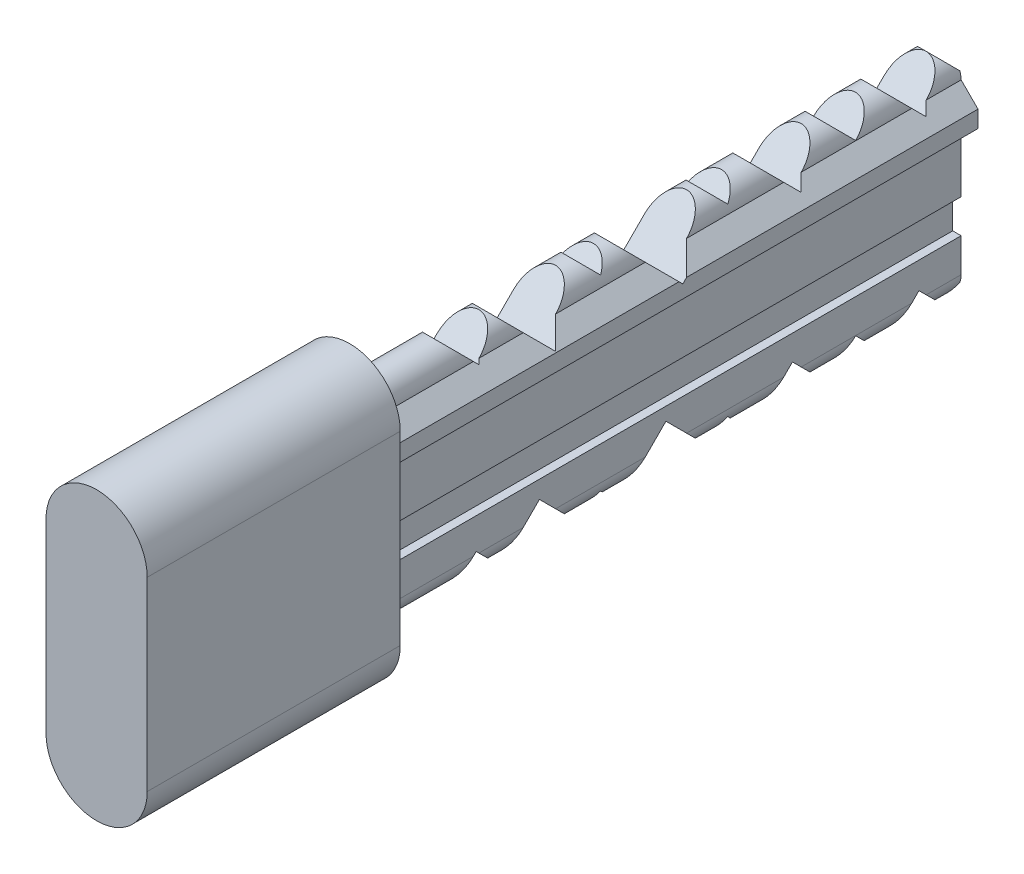
from build123d import *

# Parameters (mm, degrees)
KEY_MAIN_EXTURSION_DEPTH = 70
KEY_HANDLE_DEPTH         = 30
KEY_CUT_DEPTH            = 74.277343039


with BuildPart() as part:
    # Szkic1 → key-main-extursion (new body)
    with BuildSketch(Plane.XY):
        with BuildLine():
            Line((-1.381684649, -3.928424018), (-1.381684649, 4.071575982))
            Line((-1.381684649, 4.071575982), (-0.381684649, 4.071575982))
            Line((-0.381684649, 4.071575982), (-0.381684649, 8.071575982))
            Line((-0.381684649, 8.071575982), (-1.381684649, 8.071575982))
            Line((-1.381684649, 8.071575982), (-1.381684649, 12.071575982))
            ThreePointArc((-1.381684649, 12.071575982), (1.118315351, 14.571575982), (3.618315351, 12.071575982))
            Line((3.618315351, 12.071575982), (5.618315351, 10.071575982))
            Line((5.618315351, 10.071575982), (5.618315351, 8.071575982))
            Line((5.618315351, 8.071575982), (3.618315351, 8.071575982))
            Line((3.618315351, 8.071575982), (3.618315351, 0.071575982))
            Line((3.618315351, 0.071575982), (2.618315351, 0.071575982))
            Line((2.618315351, 0.071575982), (2.618315351, -3.928424018))
            Line((2.618315351, -3.928424018), (3.618315351, -3.928424018))
            Line((3.618315351, -3.928424018), (3.618315351, -7.928424018))
            ThreePointArc((3.618315351, -7.928424018), (1.118315351, -10.428424018), (-1.381684649, -7.928424018))
            Line((-1.381684649, -7.928424018), (-3.381684649, -5.928424018))
            Line((-3.381684649, -5.928424018), (-3.381684649, -3.928424018))
            Line((-3.381684649, -3.928424018), (-1.381684649, -3.928424018))
        make_face()
    extrude(amount=-KEY_MAIN_EXTURSION_DEPTH)

    # key-handle-sketch → key-handle (add)
    with BuildSketch(Plane.XY):
        with BuildLine():
            Line((-4.881684649, -9.253034266), (-4.881684649, 12.746965734))
            ThreePointArc((-4.881684649, 12.746965734), (1.118315351, 18.746965734), (7.118315351, 12.746965734))
            Line((7.118315351, 12.746965734), (7.118315351, -9.253034266))
            ThreePointArc((7.118315351, -9.253034266), (1.118315351, -15.253034266), (-4.881684649, -9.253034266))
        make_face()
    extrude(amount=KEY_HANDLE_DEPTH)

    # Szkic5 → key-cut (cut, through all)
    with BuildSketch(Plane.ZY.offset(3.75)):
        Polygon((-9.671572875, 14.571575982), (-15.328427125, 14.571575982), (-12.5, 11.743148857), align=None)
        Polygon((-15.580582618, 14.571575982), (-24.419417382, 14.571575982), (-20, 10.1521586), align=None)
        Polygon((-26.085786438, 14.571575982), (-28.914213562, 14.571575982), (-27.5, 13.15736242), align=None)
        Polygon((-30.050252532, 14.571575982), (-39.949747468, 14.571575982), (-35, 9.621828514), align=None)
        Polygon((-40.909009742, 14.571575982), (-44.090990258, 14.571575982), (-42.5, 12.980585724), align=None)
        Polygon((-46.464466094, 14.571575982), (-53.535533906, 14.571575982), (-50, 11.036042076), align=None)
        Polygon((-55.025126266, 14.571575982), (-59.974873734, 14.571575982), (-57.5, 12.096702248), align=None)
        Polygon((-61.641242789, 14.571575982), (-68.358757211, 14.571575982), (-65, 11.212818771), align=None)
        Polygon((-68.358757211, 14.571575982), (-70, 14.571575982), (-70, 12.930333193), align=None)
        Polygon((-70, -8.787181229), (-70, -10.428424018), (-68.358757211, -10.428424018), align=None)
        Polygon((-12.5, -7.599996893), (-15.328427125, -10.428424018), (-9.671572875, -10.428424018), align=None)
        Polygon((-20, -6.009006636), (-24.419417382, -10.428424018), (-15.580582618, -10.428424018), align=None)
        Polygon((-27.5, -9.014210456), (-28.914213562, -10.428424018), (-26.085786438, -10.428424018), align=None)
        Polygon((-35, -5.47867655), (-39.949747468, -10.428424018), (-30.050252532, -10.428424018), align=None)
        Polygon((-42.5, -8.83743376), (-44.090990258, -10.428424018), (-40.909009742, -10.428424018), align=None)
        Polygon((-50, -6.892890112), (-53.535533906, -10.428424018), (-46.464466094, -10.428424018), align=None)
        Polygon((-57.5, -7.953550284), (-59.974873734, -10.428424018), (-55.025126266, -10.428424018), align=None)
        Polygon((-65, -7.069666807), (-68.358757211, -10.428424018), (-61.641242789, -10.428424018), align=None)
    extrude(amount=-KEY_CUT_DEPTH, mode=Mode.SUBTRACT)


solid = part.part
